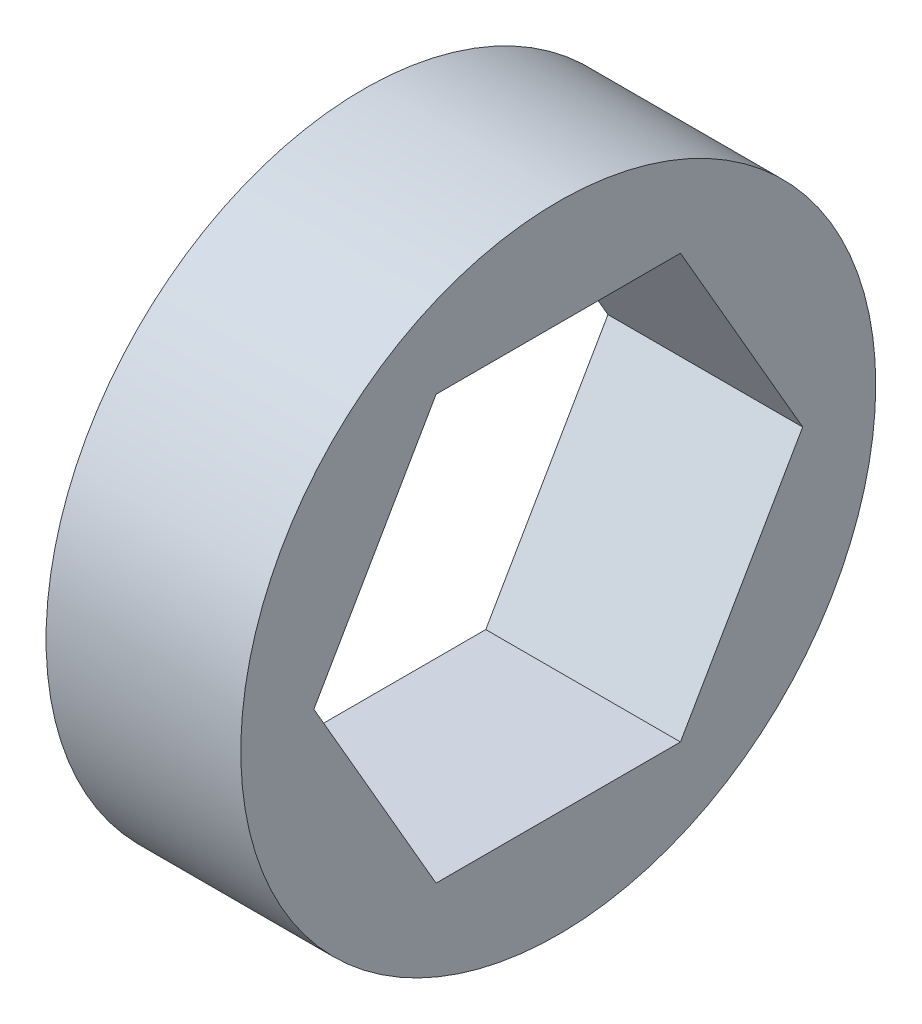
from build123d import *

# Parameters (mm, degrees)
SKETCH1_R           = 9.525
BOSS_EXTRUDE1_DEPTH = 5.842


with BuildPart() as part:
    # Sketch1 → Boss-Extrude1 (new body)
    with BuildSketch(Plane(origin=(0, 0, 0), x_dir=(0, 0, -1), z_dir=(1, 0, 0))):
        Circle(SKETCH1_R)
        Polygon((7.332348419, 0), (3.666174209, 6.35), (-3.666174209, 6.35), (-7.332348419, 0), (-3.666174209, -6.35), (3.666174209, -6.35), align=None, mode=Mode.SUBTRACT)
    extrude(amount=BOSS_EXTRUDE1_DEPTH)


solid = part.part
